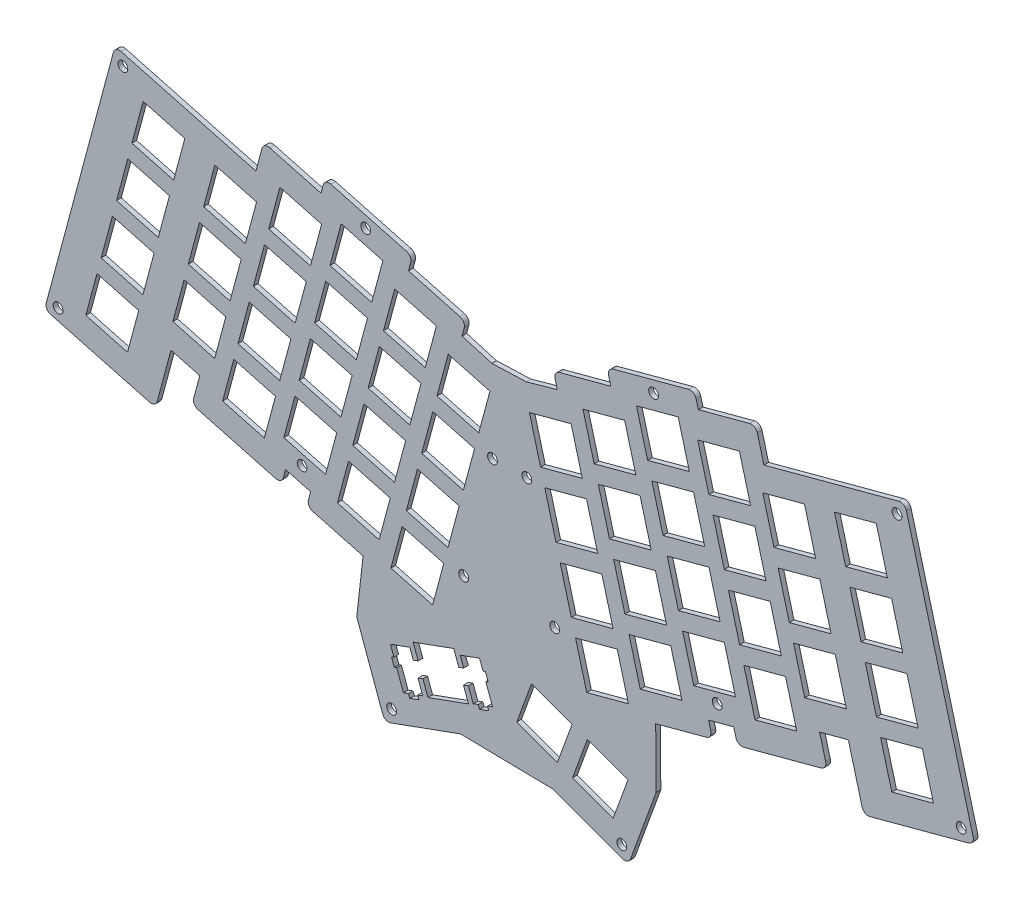
from build123d import *

# Parameters (mm, degrees)
MODEL_R             = 1.575
MODEL_R_2           = 1.591567146
BOSS_EXTRUDE1_DEPTH = 1.5
FILLET2_R           = 2


with BuildPart() as part:
    # Model → Boss-Extrude1 (new body)
    with BuildSketch(Plane.XY):
        Polygon((142.344747242, 270.871489374), (153.37187249, 271.263447748), (163.316169572, 274.060270147), (162.083716803, 278.660647697), (180.485310962, 283.590481264), (179.253230336, 288.191236578), (207.312407077, 295.710458331), (208.545361773, 291.109490989), (226.945607443, 296.038963293), (229.56959781, 286.244392107), (274.73877463, 298.347764451), (297.175041676, 214.616744319), (261.579755866, 205.080677318), (256.650437456, 223.480348551), (247.426233646, 221.008791549), (249.89106143, 211.808326678), (221.129340298, 204.10298892), (219.896864345, 208.702169757), (211.857184917, 206.548319326), (213.089929955, 201.948134355), (194.867957109, 197.065059706), (195.008110633, 178.017763213), (186.104682866, 153.560584577), (161.750714436, 162.423378067), (132.268010987, 162.937506746), (107.997440169, 154.10642013), (99.000002828, 178.834174445), (101.026143499, 196.720247586), (82.983307396, 201.553968964), (84.215835144, 206.154626391), (76.175699939, 208.308598926), (74.943696519, 203.709898661), (46.181611491, 211.415333909), (48.646491676, 220.615788051), (39.422405117, 223.086999562), (34.492804645, 204.68781559), (-1.102096008, 214.224577618), (21.49265485, 298.550084359), (66.66289487, 286.446862464), (69.128643718, 295.647698615), (87.528001371, 290.715713524), (88.76145587, 295.317775741), (116.81968688, 287.796710081), (115.587326993, 283.198731898), (133.986548098, 278.26678341), (132.754288522, 273.669179493), align=None)
        with Locations((23.99266446, 294.219962888)):
            Circle(MODEL_R, mode=Mode.SUBTRACT)
        with Locations((110.177866393, 158.781169686)):
            Circle(MODEL_R, mode=Mode.SUBTRACT)
        with Locations((183.991625175, 158.092139188)):
            Circle(MODEL_R, mode=Mode.SUBTRACT)
        with Locations((194.197688714, 288.535732102)):
            Circle(MODEL_R, mode=Mode.SUBTRACT)
        with Locations((101.875275484, 288.142241676)):
            Circle(MODEL_R, mode=Mode.SUBTRACT)
        with Locations((272.238803957, 294.0176205)):
            Circle(MODEL_R_2, mode=Mode.SUBTRACT)
        with Locations((3.227999965, 216.724631391)):
            Circle(MODEL_R, mode=Mode.SUBTRACT)
        with Locations((292.844960618, 217.116823923)):
            Circle(MODEL_R_2, mode=Mode.SUBTRACT)
        with Locations((81.489652482, 212.061298133)):
            Circle(MODEL_R, mode=Mode.SUBTRACT)
        with Locations((214.582802855, 212.454839779)):
            Circle(MODEL_R, mode=Mode.SUBTRACT)
        with Locations((133.281102646, 207.339464548)):
            Circle(MODEL_R, mode=Mode.SUBTRACT)
        with Locations((162.46850521, 207.598897954)):
            Circle(MODEL_R, mode=Mode.SUBTRACT)
        with Locations((142.522359716, 244.531276159)):
            Circle(MODEL_R, mode=Mode.SUBTRACT)
        with Locations((153.549484965, 244.723703681)):
            Circle(MODEL_R, mode=Mode.SUBTRACT)
        Polygon((168.22, 168.742), (181.234, 164.006), (185.972, 177.021), (172.956, 181.758), align=None, mode=Mode.SUBTRACT)
        Polygon((132.176, 184.752), (133.281, 181.717), (131.706, 181.144), (130.099, 185.56), (117.085, 180.823), (118.692, 176.407), (117.118, 175.834), (116.013, 178.869), (109.812, 176.612), (110.917, 173.576), (110.141, 173.294), (111.048, 170.804), (111.822, 171.086), (113.968, 165.194), (115.588, 165.784), (115.999, 164.656), (118.959, 165.734), (118.549, 166.861), (120.169, 167.452), (118.641, 171.651), (120.215, 172.224), (121.821, 167.809), (134.837, 172.545), (133.23, 176.962), (134.804, 177.535), (136.332, 173.335), (137.953, 173.925), (138.363, 172.796), (141.323, 173.874), (140.913, 175.001), (142.533, 175.592), (140.389, 181.483), (141.165, 181.766), (140.258, 184.256), (139.484, 183.974), (138.378, 187.009), align=None, mode=Mode.SUBTRACT)
        Polygon((150.319, 175.258), (163.333, 170.521), (168.071, 183.535), (155.055, 188.273), align=None, mode=Mode.SUBTRACT)
        Polygon((109.952, 197.835), (123.33, 194.251), (126.916, 207.629), (113.537, 211.213), align=None, mode=Mode.SUBTRACT)
        Polygon((169.157, 208.022), (172.741, 194.644), (186.119, 198.228), (182.535, 211.607), align=None, mode=Mode.SUBTRACT)
        Polygon((92.7848, 207.366), (106.163, 203.781), (109.747, 217.159), (96.369, 220.744), align=None, mode=Mode.SUBTRACT)
        Polygon((186.326, 217.552), (189.91, 204.174), (203.288, 207.759), (199.704, 221.137), align=None, mode=Mode.SUBTRACT)
        Polygon((114.883, 216.236), (128.261, 212.652), (131.845, 226.03), (118.467, 229.614), align=None, mode=Mode.SUBTRACT)
        Polygon((164.226, 226.423), (167.812, 213.045), (181.19, 216.629), (177.604, 230.007), align=None, mode=Mode.SUBTRACT)
        Polygon((75.6158, 216.896), (88.9938, 213.312), (92.5781, 226.69), (79.2, 230.274), align=None, mode=Mode.SUBTRACT)
        Polygon((55.9827, 217.227), (69.3607, 213.643), (72.9449, 227.021), (59.5672, 230.605), align=None, mode=Mode.SUBTRACT)
        Polygon((203.494, 227.083), (207.078, 213.705), (220.457, 217.29), (216.872, 230.668), align=None, mode=Mode.SUBTRACT)
        Polygon((223.128, 227.414), (226.712, 214.036), (240.09, 217.62), (236.506, 230.998), align=None, mode=Mode.SUBTRACT)
        Polygon((12.1157, 219.121), (25.4937, 215.536), (29.078, 228.914), (15.7, 232.499), align=None, mode=Mode.SUBTRACT)
        Polygon((266.995, 229.307), (270.579, 215.929), (283.957, 219.513), (280.373, 232.891), align=None, mode=Mode.SUBTRACT)
        Polygon((97.7138, 225.767), (111.092, 222.183), (114.677, 235.56), (101.299, 239.145), align=None, mode=Mode.SUBTRACT)
        Polygon((181.394, 235.953), (184.98, 222.575), (198.357, 226.159), (194.773, 239.538), align=None, mode=Mode.SUBTRACT)
        Polygon((40.0473, 231.357), (53.425, 227.773), (57.0096, 241.151), (43.6316, 244.735), align=None, mode=Mode.SUBTRACT)
        Polygon((239.062, 241.545), (242.648, 228.166), (256.024, 231.75), (252.44, 245.128), align=None, mode=Mode.SUBTRACT)
        Polygon((119.814, 234.637), (133.192, 231.053), (136.776, 244.431), (123.396, 248.015), align=None, mode=Mode.SUBTRACT)
        Polygon((159.297, 244.824), (162.88, 231.445), (176.258, 235.03), (172.675, 248.408), align=None, mode=Mode.SUBTRACT)
        Polygon((80.5462, 235.297), (93.9243, 231.713), (97.5099, 245.091), (84.1304, 248.675), align=None, mode=Mode.SUBTRACT)
        Polygon((60.912, 235.628), (74.2901, 232.044), (77.8757, 245.422), (64.4977, 249.006), align=None, mode=Mode.SUBTRACT)
        Polygon((198.563, 245.484), (202.147, 232.106), (215.525, 235.692), (211.941, 249.069), align=None, mode=Mode.SUBTRACT)
        Polygon((218.196, 245.814), (221.782, 232.436), (235.16, 236.021), (231.574, 249.399), align=None, mode=Mode.SUBTRACT)
        Polygon((17.045, 237.521), (30.423, 233.937), (34.0086, 247.315), (20.6306, 250.899), align=None, mode=Mode.SUBTRACT)
        Polygon((262.063, 247.708), (265.649, 234.33), (279.026, 237.914), (275.442, 251.292), align=None, mode=Mode.SUBTRACT)
        Polygon((102.646, 244.168), (116.024, 240.584), (119.607, 253.962), (106.229, 257.546), align=None, mode=Mode.SUBTRACT)
        Polygon((176.465, 254.354), (180.049, 240.976), (193.427, 244.56), (189.843, 257.938), align=None, mode=Mode.SUBTRACT)
        Polygon((44.9778, 249.759), (58.3558, 246.174), (61.94, 259.553), (48.562, 263.136), align=None, mode=Mode.SUBTRACT)
        Polygon((234.133, 259.945), (237.717, 246.567), (251.095, 250.151), (247.511, 263.529), align=None, mode=Mode.SUBTRACT)
        Polygon((124.743, 253.038), (138.122, 249.454), (141.707, 262.832), (128.329, 266.416), align=None, mode=Mode.SUBTRACT)
        Polygon((154.365, 263.224), (157.951, 249.845), (171.329, 253.432), (167.743, 266.809), align=None, mode=Mode.SUBTRACT)
        Polygon((85.477, 253.699), (98.855, 250.114), (102.439, 263.492), (89.0612, 267.076), align=None, mode=Mode.SUBTRACT)
        Polygon((65.8442, 254.03), (79.2219, 250.443), (82.8065, 263.823), (69.427, 267.407), align=None, mode=Mode.SUBTRACT)
        Polygon((193.632, 263.885), (197.218, 250.507), (210.596, 254.092), (207.01, 267.47), align=None, mode=Mode.SUBTRACT)
        Polygon((213.267, 264.215), (216.851, 250.837), (230.229, 254.422), (226.645, 267.8), align=None, mode=Mode.SUBTRACT)
        Polygon((21.977, 255.922), (35.355, 252.338), (38.9378, 265.716), (25.5598, 269.3), align=None, mode=Mode.SUBTRACT)
        Polygon((257.132, 266.109), (260.718, 252.729), (274.096, 256.315), (270.512, 269.693), align=None, mode=Mode.SUBTRACT)
        Polygon((107.575, 262.569), (120.953, 258.984), (124.539, 272.362), (111.161, 275.947), align=None, mode=Mode.SUBTRACT)
        Polygon((171.534, 272.755), (175.118, 259.377), (188.496, 262.961), (184.912, 276.339), align=None, mode=Mode.SUBTRACT)
        Polygon((49.9071, 268.159), (63.2852, 264.575), (66.8708, 277.953), (53.4928, 281.537), align=None, mode=Mode.SUBTRACT)
        Polygon((229.201, 278.346), (232.786, 264.968), (246.164, 268.554), (242.579, 281.932), align=None, mode=Mode.SUBTRACT)
        Polygon((90.4074, 272.099), (103.785, 268.515), (107.37, 281.893), (93.992, 285.477), align=None, mode=Mode.SUBTRACT)
        Polygon((70.7732, 272.43), (84.1513, 268.844), (87.7369, 282.222), (74.3589, 285.808), align=None, mode=Mode.SUBTRACT)
        Polygon((188.703, 282.286), (192.286, 268.908), (205.664, 272.493), (202.081, 285.871), align=None, mode=Mode.SUBTRACT)
        Polygon((208.336, 282.616), (211.92, 269.238), (225.298, 272.822), (221.714, 286.2), align=None, mode=Mode.SUBTRACT)
        Polygon((26.9062, 274.323), (40.284, 270.739), (43.8697, 284.117), (30.4919, 287.701), align=None, mode=Mode.SUBTRACT)
        Polygon((252.203, 284.508), (255.786, 271.131), (269.165, 274.716), (265.581, 288.094), align=None, mode=Mode.SUBTRACT)
    extrude(amount=-BOSS_EXTRUDE1_DEPTH)

    # Fillet2
    fillet2_edges = [part.edges().sort_by_distance(p)[0] for p in [
        (-1.102096008, 214.224577618, -0.75),
        (21.49265485, 298.550084359, -0.75),
        (69.128643718, 295.647698615, -0.75),
        (88.76145587, 295.317775741, -0.75),
        (116.81968688, 287.796710081, -0.75),
        (133.986548098, 278.26678341, -0.75),
        (162.083716803, 278.660647697, -0.75),
        (179.253230336, 288.191236578, -0.75),
        (207.312407077, 295.710458331, -0.75),
        (226.945607443, 296.038963293, -0.75),
        (274.73877463, 298.347764451, -0.75),
        (297.175041676, 214.616744319, -0.75),
        (261.579755866, 205.080677318, -0.75),
        (249.89106143, 211.808326678, -0.75),
        (221.129340298, 204.10298892, -0.75),
        (213.089929955, 201.948134355, -0.75),
        (186.104682866, 153.560584577, -0.75),
        (107.997440169, 154.10642013, -0.75),
        (82.983307396, 201.553968964, -0.75),
        (74.943696519, 203.709898661, -0.75),
        (46.181611491, 211.415333909, -0.75),
        (34.492804645, 204.68781559, -0.75),
    ]]
    fillet(fillet2_edges, radius=FILLET2_R)


solid = part.part
